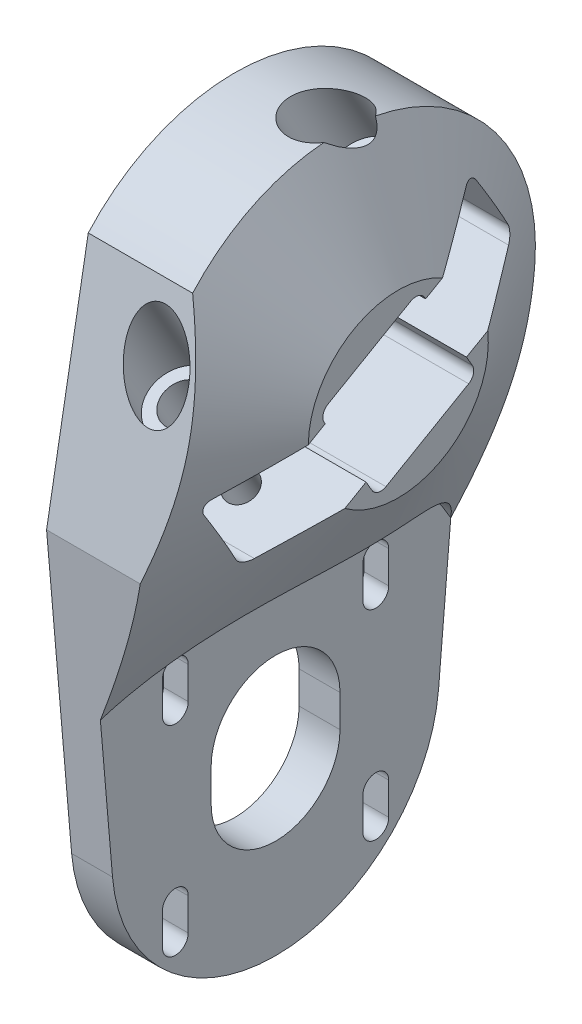
from build123d import *

# Parameters (mm, degrees)
BOSS_EXTRUDE1_DEPTH = 6.35
CUT_EXTRUDE18_DEPTH = 10
SKETCH20_R          = 57.15
BOSS_EXTRUDE5_DEPTH = 19.05
CUT_EXTRUDE14_DEPTH = 106.568863781
SKETCH22_R          = 3.175
CUT_EXTRUDE15_DEPTH = 113.468245739
SKETCH24_R          = 5
CUT_EXTRUDE16_DEPTH = 118.41300701
SKETCH25_R          = 2.38125
CUT_EXTRUDE17_DEPTH = 10
CHAMFER2_SIZE       = 2.5
FILLET1_R           = 1.5875
SKETCH28_R          = 31
CUT_EXTRUDE19_DEPTH = 105.22344993
CUT_EXTRUDE20_DEPTH = 100.584343315
CUT_EXTRUDE21_DEPTH = 94.849309593


with BuildPart() as part:
    # Sketch1 → Boss-Extrude1 (new body)
    with BuildSketch(Plane(origin=(0, 0, 0), x_dir=(0, 0, -1), z_dir=(1, 0, 0))):
        with BuildLine():
            ThreePointArc((30.369265969, -2.595782062), (0, 30.48), (-30.369265969, -2.595782062))
            Line((-30.369265969, -2.595782062), (-25.307721641, -61.813151718))
            ThreePointArc((-25.307721641, -61.813151718), (0, -85.05), (25.307721641, -61.813151718))
            Line((25.307721641, -61.813151718), (30.369265969, -2.595782062))
        make_face()
        Polygon((-12.294228634, 3.294228634), (3.294228634, 12.294228634), (12.294228634, -3.294228634), (-3.294228634, -12.294228634), align=None, mode=Mode.SUBTRACT)
    extrude(amount=BOSS_EXTRUDE1_DEPTH)

    # Sketch19 → Cut-Extrude18 (cut)
    with BuildSketch(Plane(origin=(6.35, 0, 0), x_dir=(0, 0, -1), z_dir=(1, 0, 0))):
        with BuildLine():
            Line((13.556349186, -39.093650814), (13.556349186, -44.093650814))
            ThreePointArc((13.556349186, -44.093650814), (15.556349186, -46.093650814), (17.556349186, -44.093650814))
            Line((17.556349186, -44.093650814), (17.556349186, -39.093650814))
            ThreePointArc((17.556349186, -39.093650814), (15.556349186, -37.093650814), (13.556349186, -39.093650814))
        make_face()
        with BuildLine():
            Line((-10, -54.65), (-10, -59.65))
            ThreePointArc((-10, -59.65), (0, -69.65), (10, -59.65))
            Line((10, -59.65), (10, -54.65))
            ThreePointArc((10, -54.65), (0, -44.65), (-10, -54.65))
        make_face()
        with BuildLine():
            Line((17.556349186, -75.206349186), (17.556349186, -70.206349186))
            ThreePointArc((17.556349186, -70.206349186), (15.556349186, -68.206349186), (13.556349186, -70.206349186))
            Line((13.556349186, -70.206349186), (13.556349186, -75.206349186))
            ThreePointArc((13.556349186, -75.206349186), (15.556349186, -77.206349186), (17.556349186, -75.206349186))
        make_face()
        with BuildLine():
            Line((-17.556349186, -39.093650814), (-17.556349186, -44.093650814))
            ThreePointArc((-17.556349186, -44.093650814), (-15.556349186, -46.093650814), (-13.556349186, -44.093650814))
            Line((-13.556349186, -44.093650814), (-13.556349186, -39.093650814))
            ThreePointArc((-13.556349186, -39.093650814), (-15.556349186, -37.093650814), (-17.556349186, -39.093650814))
        make_face()
        with BuildLine():
            Line((-13.556349186, -75.206349186), (-13.556349186, -70.206349186))
            ThreePointArc((-13.556349186, -70.206349186), (-15.556349186, -68.206349186), (-17.556349186, -70.206349186))
            Line((-17.556349186, -70.206349186), (-17.556349186, -75.206349186))
            ThreePointArc((-17.556349186, -75.206349186), (-15.556349186, -77.206349186), (-13.556349186, -75.206349186))
        make_face()
    extrude(amount=-CUT_EXTRUDE18_DEPTH, mode=Mode.SUBTRACT)

    # Sketch20 → Boss-Extrude5 (add)
    with BuildSketch(Plane(origin=(6.35, 0, 0), x_dir=(0, 0, -1), z_dir=(1, 0, 0))):
        Circle(SKETCH20_R)
    extrude(amount=BOSS_EXTRUDE5_DEPTH)

    # Sketch21 → Cut-Extrude14 (cut, through all)
    with BuildSketch(Plane.ZY):
        Polygon((-17.229490682, 18.15764675), (-23.579490682, 7.159124122), (-10.589109625, -0.340875878), (-12.294228634, -3.294228634), (3.294228634, -12.294228634), (4.999347643, -9.340875878), (18.389929189, -17.071931738), (24.739929189, -6.07340911), (11.349347643, 1.65764675), (12.294228634, 3.294228634), (-3.294228634, 12.294228634), (-4.239109625, 10.65764675), align=None)
    extrude(amount=-CUT_EXTRUDE14_DEPTH, mode=Mode.SUBTRACT)

    # Sketch22 → Cut-Extrude15 (cut, through all)
    with BuildSketch(Plane(origin=(0, 6.15764675, 3.555119009), x_dir=(-1, 0, 0), z_dir=(0, -0.8660254037844379, -0.5000000000000013))):
        with Locations((-12.5, -16.5)):
            Circle(SKETCH22_R)
    cut_extrude15 = extrude(amount=-CUT_EXTRUDE15_DEPTH, mode=Mode.SUBTRACT)

    # Sketch24 → Cut-Extrude16 (cut, through all)
    with BuildSketch(Plane(origin=(0, 10.557055801, 6.095119009), x_dir=(-1, 0, 0), z_dir=(0, -0.8660254037844379, -0.5000000000000013))):
        with Locations((-12.5, -16.5)):
            Circle(SKETCH24_R)
    cut_extrude16 = extrude(amount=-CUT_EXTRUDE16_DEPTH, mode=Mode.SUBTRACT)

    # Sketch25 → Cut-Extrude17 (cut)
    with BuildSketch(Plane(origin=(0, -4.840875878, -2.794880991), x_dir=(1, 0, 0), z_dir=(0, 0.8660254037844382, 0.5000000000000011))):
        with Locations((12.5, -16.5)):
            Circle(SKETCH25_R)
    cut_extrude17 = extrude(amount=-CUT_EXTRUDE17_DEPTH, mode=Mode.SUBTRACT)

    # Mirror1: Cut-Extrude15, Cut-Extrude16, Cut-Extrude17 across plane
    add(cut_extrude15.mirror(Plane(origin=(0, 0, 0), x_dir=(0, 0.8660254037844378, 0.5000000000000013), z_dir=(0, 0.5000000000000016, -0.8660254037844378))), mode=Mode.SUBTRACT)
    add(cut_extrude16.mirror(Plane(origin=(0, 0, 0), x_dir=(0, 0.8660254037844378, 0.5000000000000013), z_dir=(0, 0.5000000000000016, -0.8660254037844378))), mode=Mode.SUBTRACT)
    add(cut_extrude17.mirror(Plane(origin=(0, 0, 0), x_dir=(0, 0.8660254037844378, 0.5000000000000013), z_dir=(0, 0.5000000000000016, -0.8660254037844378))), mode=Mode.SUBTRACT)


with BuildPart() as body_2:
    # Mirror2: mirrored copy
    add(part.part.mirror(Plane(origin=(0, 0, 0), x_dir=(0, 0, 1), z_dir=(1, 0, 0))))


with BuildPart() as part_1:
    add(part.part)

    # Chamfer2
    chamfer2_edges = [part_1.edges().sort_by_distance(p)[0] for p in [
        (0, -46.093650814, 15.556349186),
        (0, -41.593650814, 13.556349186),
        (0, -37.093650814, 15.556349186),
        (0, -41.593650814, 17.556349186),
        (0, -46.093650814, -15.556349186),
        (0, -41.593650814, -17.556349186),
        (0, -41.593650814, -13.556349186),
        (0, -37.093650814, -15.556349186),
    ]]
    chamfer(chamfer2_edges, length=CHAMFER2_SIZE)

    # Fillet1
    fillet1_edges = [part_1.edges().sort_by_distance(p)[0] for p in [
        (12.7, -3.294228634, -12.294228634),
        (12.7, 7.159124122, -23.579490682),
        (12.7, 12.294228634, -3.294228634),
        (12.7, 18.15764675, -17.229490682),
        (12.7, -6.07340911, 24.739929189),
        (12.7, 3.294228634, 12.294228634),
        (12.7, -12.294228634, 3.294228634),
        (12.7, -17.071931738, 18.389929189),
    ]]
    fillet(fillet1_edges, radius=FILLET1_R)

    # Sketch28 → Cut-Extrude19 (cut, through all)
    with BuildSketch(Plane(origin=(6.35, 0, 0), x_dir=(0, 0, -1), z_dir=(1, 0, 0))):
        with Locations((0, -54.65)):
            Circle(SKETCH28_R)
    extrude(amount=CUT_EXTRUDE19_DEPTH, mode=Mode.SUBTRACT)

    # Sketch31 → Cut-Revolve1 (revolve, cut)
    with BuildSketch(Plane(origin=(0, 0, 0), x_dir=(1, 0, 0), z_dir=(0, 1, 0))):
        Polygon((25.4, -59.952108656), (25.4, -13.97), (6.35, -48.172984338), (6.35, -59.952108656), align=None)
    revolve(axis=Axis((25.4, 0, 0), (-1, 0, 0)), mode=Mode.SUBTRACT)

    # Sketch32 → Cut-Extrude20 (cut, through all)
    with BuildSketch(Plane.ZY.offset(-6.35)):
        with BuildLine():
            ThreePointArc((-30.369265969, -2.595782062), (0, 30.48), (30.369265969, -2.595782062))
            Line((30.369265969, -2.595782062), (27.192308406, -39.764491491))
            ThreePointArc((27.192308406, -39.764491491), (42.606167787, -22.480010821), (48.172984338, 0))
            ThreePointArc((48.172984338, 0), (-22.480010821, 42.606167787), (-27.192308406, -39.764491491))
            Line((-27.192308406, -39.764491491), (-30.369265969, -2.595782062))
        make_face()
    extrude(amount=-CUT_EXTRUDE20_DEPTH, mode=Mode.SUBTRACT)

    # Sketch33 → Cut-Extrude21 (cut, through all)
    with BuildSketch(Plane.ZY):
        with BuildLine():
            Line((29.192652415, -16.361533231), (30.369265969, -2.595782062))
            ThreePointArc((30.369265969, -2.595782062), (28.913089259, 9.646951307), (22.726245723, 20.311281479))
            Line((22.726245723, 20.311281479), (29.192652415, -16.361533231))
        make_face()
    extrude(amount=-CUT_EXTRUDE21_DEPTH, mode=Mode.SUBTRACT)


solid = part_1.part
